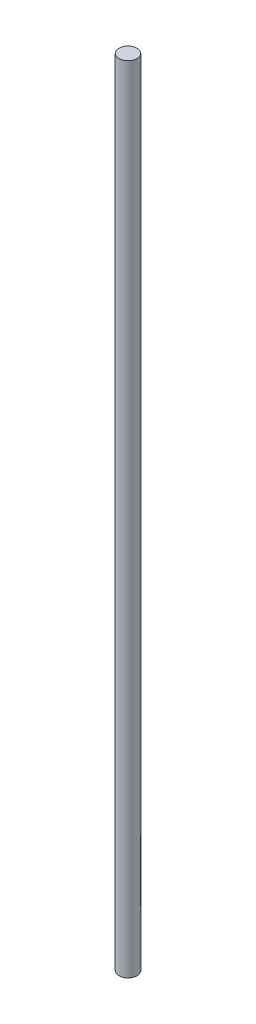
from build123d import *

# Parameters (mm, degrees)
SKETCH1_R           = 3.175
BOSS_EXTRUDE1_DEPTH = 139.7


with BuildPart() as part:
    # Sketch1 → Boss-Extrude1 (new, symmetric)
    with BuildSketch(Plane(origin=(0, 0, 0), x_dir=(1, 0, 0), z_dir=(0, 1, 0))):
        with Locations(Location((0, 0, 0), (0, 0, 270))):
            Circle(SKETCH1_R)
    extrude(amount=BOSS_EXTRUDE1_DEPTH, both=True)


solid = part.part
